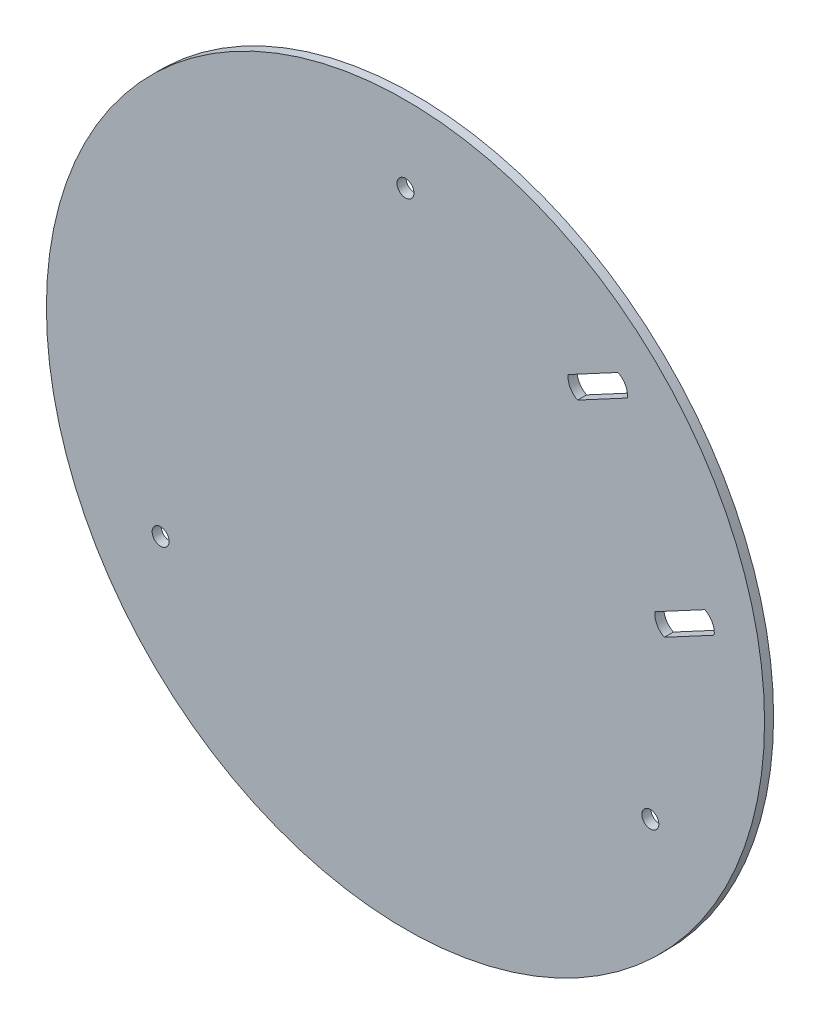
from build123d import *

# Parameters (mm, degrees)
SKETCH1_R           = 63.5
BOSS_EXTRUDE1_DEPTH = 1.6
SKETCH3_R           = 1.75
CUT_EXTRUDE4_DEPTH  = 1.6
SKETCH2_R           = 1.5
CUT_EXTRUDE5_DEPTH  = 1.6
CUT_EXTRUDE6_DEPTH  = 10


with BuildPart() as part:
    # Sketch1 → Boss-Extrude1 (new body)
    with BuildSketch(Plane.XY):
        Circle(SKETCH1_R)
    extrude(amount=BOSS_EXTRUDE1_DEPTH)

    # Sketch3 → Cut-Extrude4 (cut)
    with BuildSketch(Plane(origin=(0, 0, 0), x_dir=(-1, 0, 0), z_dir=(0, 0, -1))):
        with Locations((-34.006305458, 36.654756705)):
            Circle(SKETCH3_R)
        with Locations((-49.354669589, 8.007283544)):
            Circle(SKETCH3_R)
    extrude(amount=-CUT_EXTRUDE4_DEPTH, mode=Mode.SUBTRACT)

    # Sketch2 → Cut-Extrude5 (cut)
    with BuildSketch(Plane(origin=(0, 0, 0), x_dir=(-1, 0, 0), z_dir=(0, 0, -1))):
        with Locations((0, 50)):
            Circle(SKETCH2_R)
        with Locations((43.301270189, -25)):
            Circle(SKETCH2_R)
        with Locations((-43.301270189, -25)):
            Circle(SKETCH2_R)
    extrude(amount=-CUT_EXTRUDE5_DEPTH, mode=Mode.SUBTRACT)

    # Sketch4 → Cut-Extrude6 (cut)
    with BuildSketch(Plane(origin=(0, 0, 0), x_dir=(-1, 0, 0), z_dir=(0, 0, -1))):
        with BuildLine():
            Line((-52.935522776, 11.911126581), (-44.12091565, 7.188553002))
            ThreePointArc((-44.12091565, 7.188553002), (-44.461118004, 5.385481223), (-45.773816402, 4.103440508))
            Line((-45.773816402, 4.103440508), (-54.588423529, 8.826014086))
            ThreePointArc((-54.588423529, 8.826014086), (-54.248221174, 10.629085865), (-52.935522776, 11.911126581))
        make_face()
        with BuildLine():
            Line((-39.240059397, 37.473487247), (-30.425452271, 32.750913668))
            ThreePointArc((-30.425452271, 32.750913668), (-29.112753873, 34.032954384), (-28.772551518, 35.836026163))
            Line((-28.772551518, 35.836026163), (-37.587158645, 40.558599742))
            ThreePointArc((-37.587158645, 40.558599742), (-38.899857043, 39.276559026), (-39.240059397, 37.473487247))
        make_face()
    extrude(amount=-CUT_EXTRUDE6_DEPTH, mode=Mode.SUBTRACT)


solid = part.part
